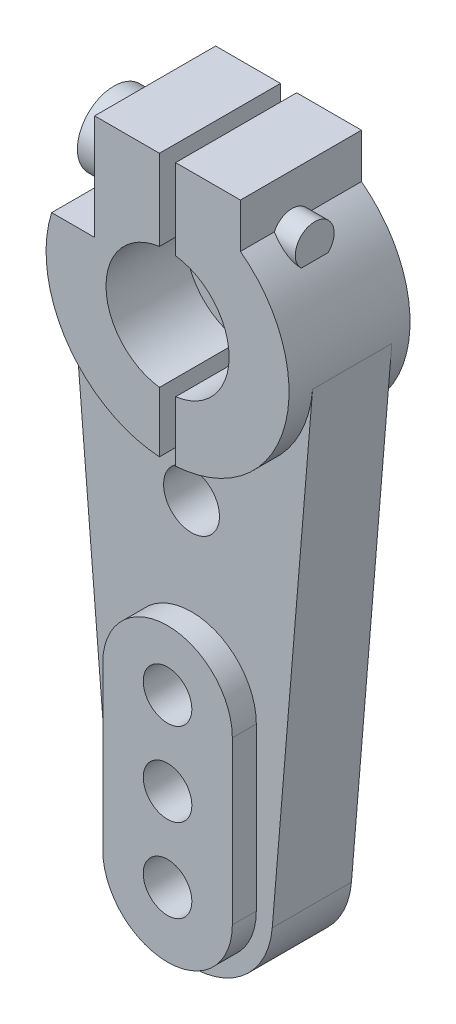
from build123d import *

# Parameters (mm, degrees)
SALIENTE_EXTRUIR1_DEPTH = 7.47
CORTAR_EXTRUIR1_START   = -1.48
CORTAR_EXTRUIR1_DEPTH   = 1.48
CORTAR_EXTRUIR2_DEPTH   = 1.1
CROQUIS4_R              = 1.5
CORTAR_EXTRUIR4_DEPTH   = 37.80507302
CROQUIS7_R              = 1.725
CORTAR_EXTRUIR5_DEPTH   = 37.533444951
CROQUIS9_W              = 1
CROQUIS9_H              = 19.05
CORTAR_EXTRUIR6_DEPTH   = 37.80507302
CROQUIS10_R             = 3.8
CORTAR_EXTRUIR7_DEPTH   = 4.93
CROQUIS11_R             = 1.5
CORTAR_EXTRUIR8_DEPTH   = 37.374680755
CROQUIS12_R             = 4.45
CORTAR_EXTRUIR9_DEPTH   = 1.1
CROQUIS14_W             = 2.654544011
CROQUIS14_H             = 6.5
CORTAR_EXTRUIR10_DEPTH  = 6.37
CROQUIS15_R             = 2.25
SALIENTE_EXTRUIR2_DEPTH = 2
CROQUIS16_R             = 1.2
SALIENTE_EXTRUIR3_DEPTH = 1.4


with BuildPart() as part:
    # Croquis1 → Saliente-Extruir1 (new body)
    with BuildSketch(Plane.XY):
        with BuildLine():
            Line((4.5, 6), (4.5, 8.75))
            Line((4.5, 8.75), (-4.5, 8.75))
            Line((-4.5, 8.75), (-4.5, 6))
            ThreePointArc((-4.5, 6), (-6.841182363, 3.073796329), (-7.47434311, -0.619834711))
            Line((-7.47434311, -0.619834711), (-4.982895407, -30.66322314))
            ThreePointArc((-4.982895407, -30.66322314), (0, -35.25), (4.982895407, -30.66322314))
            Line((4.982895407, -30.66322314), (7.47434311, -0.619834711))
            ThreePointArc((7.47434311, -0.619834711), (6.841182363, 3.073796329), (4.5, 6))
        make_face()
    extrude(amount=SALIENTE_EXTRUIR1_DEPTH)

    # Croquis2 → Cortar-Extruir1 (cut)
    with BuildSketch(Plane.XY.offset(7.47).offset(CORTAR_EXTRUIR1_START)):
        with BuildLine():
            ThreePointArc((7.47434311, -0.619834711), (0, -7.5), (-7.47434311, -0.619834711))
            Line((-7.47434311, -0.619834711), (-4.982895407, -30.66322314))
            ThreePointArc((-4.982895407, -30.66322314), (0, -35.25), (4.982895407, -30.66322314))
            Line((4.982895407, -30.66322314), (7.47434311, -0.619834711))
        make_face()
        with BuildLine():
            ThreePointArc((4, -30.25), (0, -34.25), (-4, -30.25))
            Line((-4, -30.25), (-4, -20.25))
            ThreePointArc((-4, -20.25), (0, -16.25), (4, -20.25))
            Line((4, -20.25), (4, -30.25))
        make_face(mode=Mode.SUBTRACT)
    extrude(amount=CORTAR_EXTRUIR1_DEPTH, mode=Mode.SUBTRACT)

    # Croquis3 → Cortar-Extruir2 (cut)
    with BuildSketch(Plane(origin=(0, 0, 0), x_dir=(-1, 0, 0), z_dir=(0, 0, -1))):
        with BuildLine():
            Line((-7.47434311, -0.619834711), (-4.982895407, -30.66322314))
            ThreePointArc((-4.982895407, -30.66322314), (0, -35.25), (4.982895407, -30.66322314))
            Line((4.982895407, -30.66322314), (7.47434311, -0.619834711))
            ThreePointArc((7.47434311, -0.619834711), (0, -7.5), (-7.47434311, -0.619834711))
        make_face()
    extrude(amount=-CORTAR_EXTRUIR2_DEPTH, mode=Mode.SUBTRACT)

    # Croquis4 → Cortar-Extruir4 (cut, through all)
    with BuildSketch(Plane.XY.offset(7.47)):
        with Locations((0, -19.970784247)):
            Circle(CROQUIS4_R)
        with Locations((0, -25.110392124)):
            Circle(CROQUIS4_R)
        with Locations((0, -30.25)):
            Circle(CROQUIS4_R)
    extrude(amount=-CORTAR_EXTRUIR4_DEPTH, mode=Mode.SUBTRACT)

    # Croquis7 → Cortar-Extruir5 (cut, through all)
    with BuildSketch(Plane.XY.offset(5.99)):
        with Locations((0, -10.3)):
            Circle(CROQUIS7_R)
    extrude(amount=-CORTAR_EXTRUIR5_DEPTH, mode=Mode.SUBTRACT)

    # Croquis9 → Cortar-Extruir6 (cut, through all)
    with BuildSketch(Plane.XY.offset(7.47)):
        with Locations((0, -0.775)):
            Rectangle(CROQUIS9_W, CROQUIS9_H)
    extrude(amount=-CORTAR_EXTRUIR6_DEPTH, mode=Mode.SUBTRACT)

    # Croquis10 → Cortar-Extruir7 (cut)
    with BuildSketch(Plane.XY.offset(7.47)):
        Circle(CROQUIS10_R)
    extrude(amount=-CORTAR_EXTRUIR7_DEPTH, mode=Mode.SUBTRACT)

    # Croquis11 → Cortar-Extruir8 (cut, through all)
    with BuildSketch(Plane.XY.offset(2.54)):
        Circle(CROQUIS11_R)
    extrude(amount=-CORTAR_EXTRUIR8_DEPTH, mode=Mode.SUBTRACT)

    # Croquis12 → Cortar-Extruir9 (cut)
    with BuildSketch(Plane(origin=(0, 0, 0), x_dir=(-1, 0, 0), z_dir=(0, 0, -1))):
        Circle(CROQUIS12_R)
    extrude(amount=-CORTAR_EXTRUIR9_DEPTH, mode=Mode.SUBTRACT)

    # Croquis14 → Cortar-Extruir10 (cut)
    with BuildSketch(Plane.XY.offset(7.47)):
        with Locations((-5.827272006, 5.5)):
            Rectangle(CROQUIS14_W, CROQUIS14_H)
    extrude(amount=-CORTAR_EXTRUIR10_DEPTH, mode=Mode.SUBTRACT)

    # Croquis15 → Saliente-Extruir2 (add)
    with BuildSketch(Plane.ZY.offset(4.5)):
        with Locations(Location((4.285, 5.5, 0), (0, 0, 180))):
            Circle(CROQUIS15_R)
    extrude(amount=SALIENTE_EXTRUIR2_DEPTH)

    # Croquis16 → Saliente-Extruir3 (add)
    with BuildSketch(Plane(origin=(4.5, 0, 0), x_dir=(0, 0, -1), z_dir=(1, 0, 0))):
        with Locations((-4.285, 5.5)):
            Circle(CROQUIS16_R)
    extrude(amount=SALIENTE_EXTRUIR3_DEPTH)


solid = part.part
